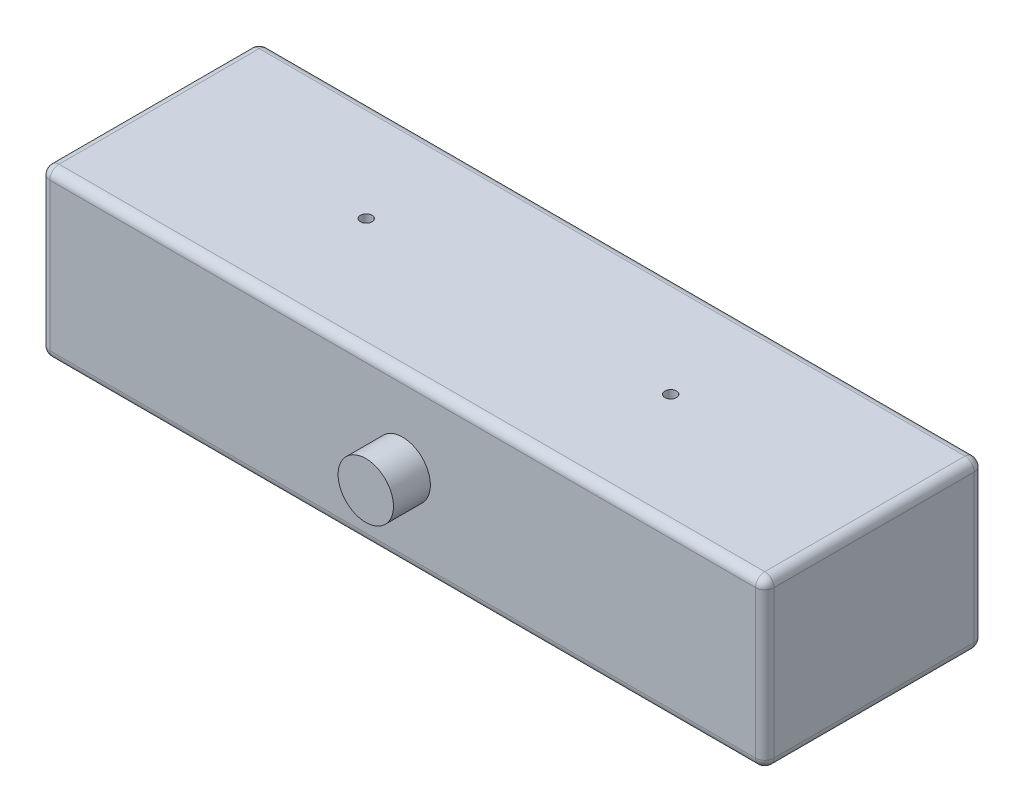
from build123d import *

# Parameters (mm, degrees)
SKETCH_1_W             = 47.4
SKETCH_1_H             = 36
EXTRUDE_1_DEPTH        = 78.5
FILLET_1_R             = 2
HOLE_WIZARD_M3_1_D     = 2.5
HOLE_WIZARD_M3_1_DEPTH = 4
HOLE_WIZARD_M3_1_TIP   = 0.751075774
SKETCH_4_R             = 9
CUT_EXTRUDE_1_DEPTH    = 2
SKETCH_5_R             = 6
EXTRUDE_2_DEPTH        = 8


with BuildPart() as part:
    # 草图1 → 凸台-拉伸1 (new, symmetric)
    with BuildSketch(Plane(origin=(0, 0, 0), x_dir=(0, 0, -1), z_dir=(1, 0, 0))):
        Rectangle(SKETCH_1_W, SKETCH_1_H)
    extrude(amount=EXTRUDE_1_DEPTH, both=True)

    # 圆角1
    fillet_1_edges = [part.edges().sort_by_distance(p)[0] for p in [
        (78.5, 0, 23.7),
        (78.5, -18, 0),
        (78.5, 0, -23.7),
        (-78.5, -18, 0),
        (-78.5, 0, 23.7),
        (-78.5, 18, 0),
        (-78.5, 0, -23.7),
        (78.5, 18, 0),
        (0, -18, -23.7),
        (0, -18, 23.7),
        (0, 18, 23.7),
        (0, 18, -23.7),
    ]]
    fillet(fillet_1_edges, radius=FILLET_1_R)

    # M3 螺纹孔1
    with Locations(Plane(origin=(0, 18, 41.7), x_dir=(1, 0, 0), z_dir=(0, 1, 0))):
        with Locations((-33, 43.1), (33, 43.1)):
            Hole(HOLE_WIZARD_M3_1_D / 2, depth=HOLE_WIZARD_M3_1_DEPTH)
            with Locations((0, 0, -(HOLE_WIZARD_M3_1_DEPTH + HOLE_WIZARD_M3_1_TIP / 2))):  # 118° drill point
                Cone(0, HOLE_WIZARD_M3_1_D / 2, HOLE_WIZARD_M3_1_TIP, mode=Mode.SUBTRACT)

    # 草图4 → 切除-拉伸1 (cut)
    with BuildSketch(Plane(origin=(0, 0, -23.7), x_dir=(-1, 0, 0), z_dir=(0, 0, -1))):
        with Locations((60, 0)):
            Circle(SKETCH_4_R)
        with Locations((-60, 0)):
            Circle(SKETCH_4_R)
    extrude(amount=-CUT_EXTRUDE_1_DEPTH, mode=Mode.SUBTRACT)

    # 草图5 → 凸台-拉伸2 (add)
    with BuildSketch(Plane.XY.offset(23.7)):
        with Locations(Location((0, 0, 0), (0, 0, 180))):
            Circle(SKETCH_5_R)
    extrude(amount=EXTRUDE_2_DEPTH)


solid = part.part
